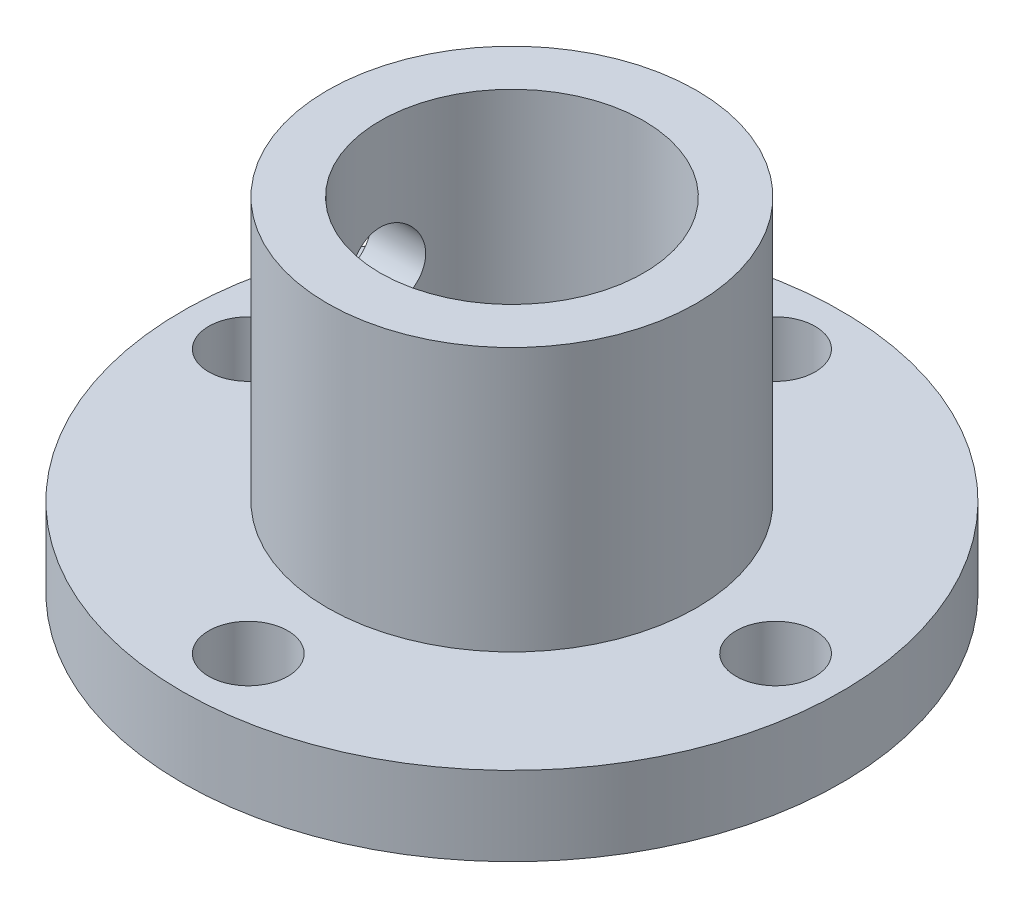
from build123d import *

# Parameters (mm, degrees)
IZIM1_R                     = 12.5
IZIM1_R_2                   = 1.5
Y_KSEKLIK_EKSTR_ZYON1_DEPTH = 3
IZIM2_R                     = 7
IZIM2_R_2                   = 5
EKSTR_ZYON_NCE1_DEPTH       = 10
IZIM3_R                     = 1.5
KES_EKSTR_ZYON1_DEPTH       = 22.943108257
IZIM2_2_R                   = 5
KES_EKSTR_ZYON2_DEPTH       = 21.310096061


with BuildPart() as part:
    # Çizim1 → Yükseklik-Ekstrüzyon1 (new body)
    with BuildSketch(Plane(origin=(0, 0, 0), x_dir=(1, 0, 0), z_dir=(0, 1, 0))):
        Circle(IZIM1_R)
        with Locations((10, 0)):
            Circle(IZIM1_R_2, mode=Mode.SUBTRACT)
        with Locations((0, -10)):
            Circle(IZIM1_R_2, mode=Mode.SUBTRACT)
        with Locations((-10, 0)):
            Circle(IZIM1_R_2, mode=Mode.SUBTRACT)
        with Locations((0, 10)):
            Circle(IZIM1_R_2, mode=Mode.SUBTRACT)
    extrude(amount=Y_KSEKLIK_EKSTR_ZYON1_DEPTH)

    # Çizim2 → Ekstrüzyon-İnce1 (add)
    with BuildSketch(Plane(origin=(0, 3, 0), x_dir=(1, 0, 0), z_dir=(0, 1, 0))):
        Circle(IZIM2_R)
        Circle(IZIM2_R_2, mode=Mode.SUBTRACT)
    extrude(amount=EKSTR_ZYON_NCE1_DEPTH)

    # Çizim3 → Kes-Ekstrüzyon1 (cut, through all)
    with BuildSketch(Plane(origin=(0, 0, 0), x_dir=(0, 0, -1), z_dir=(1, 0, 0))):
        with Locations((0, 8)):
            Circle(IZIM3_R)
    extrude(amount=-KES_EKSTR_ZYON1_DEPTH, mode=Mode.SUBTRACT)

    # Çizim2<2> → Kes-Ekstrüzyon2 (cut, through all)
    with BuildSketch(Plane(origin=(0, 3, 0), x_dir=(1, 0, 0), z_dir=(0, 1, 0))):
        Circle(IZIM2_2_R)
    extrude(amount=-KES_EKSTR_ZYON2_DEPTH, mode=Mode.SUBTRACT)


solid = part.part
